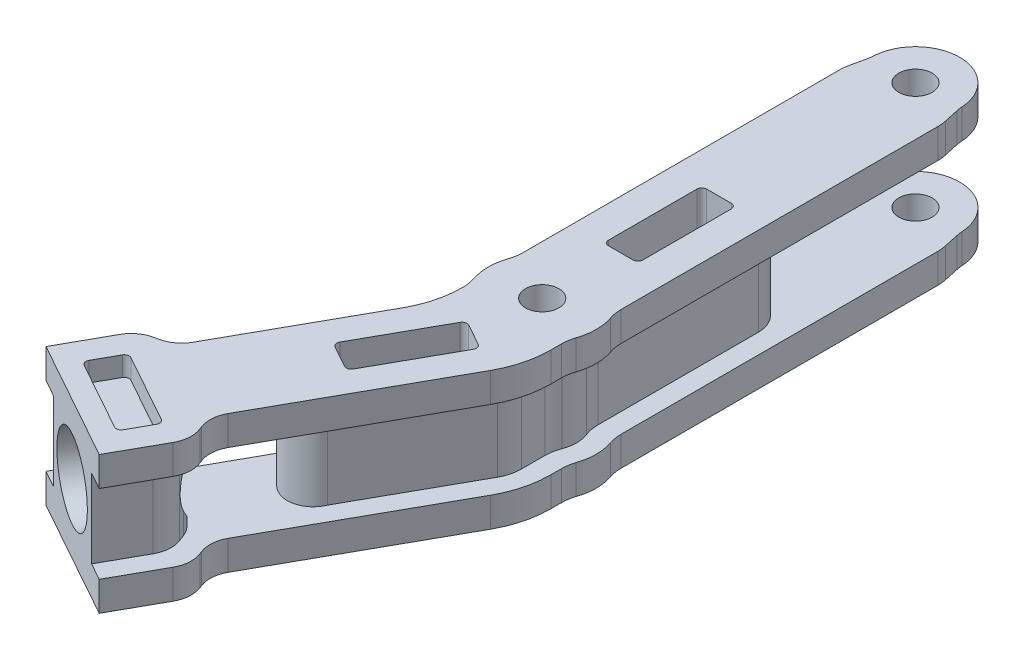
from build123d import *

# Parameters (mm, degrees)
SKETCH_1_R           = 1.75
EXTRUDE_1_DEPTH      = 3
EXTRUDE_START        = -3
EXTRUDE_2_DEPTH      = 3
SKETCH_5_R           = 2
CUT_EXTRUDE_1_DEPTH  = 10
SKETCH_8_R           = 1.6
SKETCH_8_R_2         = 2
SKETCH_8_R_3         = 1.75
EXTRUDE_4_DEPTH      = 3
SKETCH_9_R           = 3
SKETCH_9_R_2         = 2.62080722
EXTRUDE_5_DEPTH      = 14
EXTRUDE_6_REACH      = 53.947
SKETCH_11_R          = 1.5
CUT_EXTRUDE_2_DEPTH  = 6
EXTRUDE_START_2      = -14
EXTRUDE_7_DEPTH      = 14
SKETCH_14_R          = 3.5
SKETCH_14_R_2        = 1.7
EXTRUDE_8_DEPTH      = 14
SKETCH_15_R          = 1.6
EXTRUDE_9_DEPTH      = 3
SKETCH_16_R          = 1.7
SKETCH_16_R_2        = 1.6
EXTRUDE_10_DEPTH     = 3
EXTRUDE_START_3      = 8
SKETCH_18_R          = 2.6
SKETCH_18_R_2        = 1.6
SKETCH_18_R_3        = 3
EXTRUDE_11_DEPTH     = 8
SKETCH_20_W          = 10
SKETCH_20_H          = 14
EXTRUDE_13_DEPTH     = 2
CUT_EXTRUDE_START    = -100
CUT_EXTRUDE_3_DEPTH  = 100
FILLET_1_R           = 10
FILLET_2_R           = 4
FILLET_3_R           = 4
FILLET_4_R           = 10
FILLET_5_R           = 3
FILLET_6_R           = 4
SKETCH_22_W          = 3.5
SKETCH_22_H          = 10
CUT_EXTRUDE_4_DEPTH  = 100
CUT_EXTRUDE_5_DEPTH  = 100
FILLET_7_R           = 0.5
CUT_EXTRUDE_6_REACH  = 78.885
SKETCH_24_R          = 1.45
FILLET_8_R           = 4
FILLET_9_R           = 4
CUT_EXTRUDE_START_2  = -6
SKETCH_25_R          = 1.7
CUT_EXTRUDE_7_DEPTH  = 6
SKETCH_26_R          = 1.7
CUT_EXTRUDE_8_DEPTH  = 50
CUT_EXTRUDE_9_DEPTH  = 2
CUT_EXTRUDE_10_DEPTH = 2
FILLET_10_R          = 0.5
SKETCH_29_R          = 4
CUT_EXTRUDE_11_DEPTH = 14


with BuildPart() as part:
    # 草图1 → 凸台-拉伸1 (new body)
    with BuildSketch(Plane(origin=(0, 0, 0), x_dir=(1, 0, 0), z_dir=(0, 1, 0))):
        with BuildLine():
            Line((-3, 17.197224362), (-3, -17.197224362))
            ThreePointArc((-3, -17.197224362), (0, -22.5), (3, -17.197224362))
            Line((3, -17.197224362), (3, 17.197224362))
            ThreePointArc((3, 17.197224362), (0, 22.5), (-3, 17.197224362))
        make_face()
        with Locations(Location((0, 19, 0), (0, 0, 270))):
            Circle(SKETCH_1_R, mode=Mode.SUBTRACT)
        with Locations(Location((0, -19, 0), (0, 0, 90))):
            Circle(SKETCH_1_R, mode=Mode.SUBTRACT)
    extrude(amount=EXTRUDE_1_DEPTH)

    # 草图4 → 凸台-拉伸2 (add)
    with BuildSketch(Plane(origin=(0, 3, 0), x_dir=(1, 0, 0), z_dir=(0, 1, 0)).offset(EXTRUDE_START)):
        with BuildLine():
            ThreePointArc((3, -20.802775638), (0, -22.5), (-3, -20.802775638))
            Line((-3, -20.802775638), (-3, -25.197224362))
            Line((-3, -25.197224362), (-14.254126999, -45.4003011))
            Line((-14.254126999, -45.4003011), (-9.675040009, -47.951082211))
            Line((-9.675040009, -47.951082211), (3, -25.197224362))
            Line((3, -25.197224362), (3, -20.802775638))
        make_face()
    extrude(amount=EXTRUDE_2_DEPTH)

    # 草图5 → 切除-拉伸1 (cut)
    with BuildSketch(Plane(origin=(0, 3, 0), x_dir=(1, 0, 0), z_dir=(0, 1, 0))):
        with Locations(Location((0, 0, 0), (0, 0, 270))):
            Circle(SKETCH_5_R)
        with Locations(Location((-6.124899246, -36.192462775, 0), (0, 0, 270))):
            Circle(SKETCH_5_R)
    extrude(amount=-CUT_EXTRUDE_1_DEPTH, mode=Mode.SUBTRACT)



with BuildPart() as body_2:
    # 草图8 → 凸台-拉伸4 (new body)
    with BuildSketch(Plane(origin=(0, -8, 0), x_dir=(-1, 0, 0), z_dir=(0, -1, 0))):
        with BuildLine():
            Line((-3, 17.197224362), (-3, -17.197224362))
            ThreePointArc((-3, -17.197224362), (-3.5, -19), (-3, -20.802775638))
            Line((-3, -20.802775638), (-3, -25.197224362))
            Line((-3, -25.197224362), (9.675040009, -47.951082211))
            Line((9.675040009, -47.951082211), (14.254126999, -45.4003011))
            Line((14.254126999, -45.4003011), (3, -25.197224362))
            Line((3, -25.197224362), (3, -20.802775638))
            ThreePointArc((3, -20.802775638), (3.5, -19), (3, -17.197224362))
            Line((3, -17.197224362), (3, 17.197224362))
            ThreePointArc((3, 17.197224362), (0, 22.5), (-3, 17.197224362))
        make_face()
        with Locations(Location((0, 19, 0), (0, 0, 90))):
            Circle(SKETCH_8_R, mode=Mode.SUBTRACT)
        with Locations(Location((0, 0, 0), (0, 0, 270))):
            Circle(SKETCH_8_R_2, mode=Mode.SUBTRACT)
        with Locations(Location((0, -19, 0), (0, 0, 90))):
            Circle(SKETCH_8_R_3, mode=Mode.SUBTRACT)
        with Locations(Location((6.124899246, -36.192462775, 0), (0, 0, 270))):
            Circle(SKETCH_8_R_2, mode=Mode.SUBTRACT)
    extrude(amount=EXTRUDE_4_DEPTH)


with BuildPart() as part_1:
    add(part.part)

    add(body_2.part)  # 凸台-拉伸5 merges body 2
    # 草图9 → 凸台-拉伸5 (add)
    with BuildSketch(Plane(origin=(0, 3, 0), x_dir=(1, 0, 0), z_dir=(0, 1, 0))):
        Circle(SKETCH_9_R)
        with Locations(Location((-6.124899246, -36.192462775, 0), (0, 0, 330.88))):
            Circle(SKETCH_9_R_2)
    extrude(amount=-EXTRUDE_5_DEPTH)

    # 凸台-拉伸6: up to this face of the body (flat: up to its plane)
    extrude_6_end = Plane(part_1.part.faces().sort_by_distance((-1.92146971, 3, 12.783833811))[0])
    # 草图10 → 凸台-拉伸6 (add, up to the picked face)
    with BuildSketch(Plane.XZ.offset(11), mode=Mode.PRIVATE) as extrude_6_sk1:
        Polygon((-14.254126999, 45.4003011), (-11.964583504, 46.675691655), (-9.675040009, 47.951082211), (-7.59657147, 49.10889343), (-9.54313289, 52.603303056), (-18.279156957, 47.736899508), (-16.332595538, 44.242489881), align=None)
    extrude_6_tool1 = split(extrude(extrude_6_sk1.sketch, amount=-EXTRUDE_6_REACH, mode=Mode.PRIVATE), bisect_by=extrude_6_end, keep=Keep.BOTH, mode=Mode.PRIVATE)
    # 草图10 → 凸台-拉伸6 (add, up to the picked face)
    with BuildSketch(Plane.XZ.offset(11), mode=Mode.PRIVATE) as extrude_6_sk2:
        Polygon((-9.675040009, 47.951082211), (-11.964583504, 46.675691655), (-10.991302794, 44.928486842), (-8.701759299, 46.203877397), align=None)
    extrude_6_tool2 = split(extrude(extrude_6_sk2.sketch, amount=-EXTRUDE_6_REACH, mode=Mode.PRIVATE), bisect_by=extrude_6_end, keep=Keep.BOTH, mode=Mode.PRIVATE)
    # 草图10 → 凸台-拉伸6 (add, up to the picked face)
    with BuildSketch(Plane.XZ.offset(11), mode=Mode.PRIVATE) as extrude_6_sk3:
        Polygon((-10.991302794, 44.928486842), (-11.964583504, 46.675691655), (-14.254126999, 45.4003011), (-13.28084629, 43.653096286), align=None)
    extrude_6_tool3 = split(extrude(extrude_6_sk3.sketch, amount=-EXTRUDE_6_REACH, mode=Mode.PRIVATE), bisect_by=extrude_6_end, keep=Keep.BOTH, mode=Mode.PRIVATE)
    add(extrude_6_tool1.solids().sort_by(Axis((-12.937864, -11, 48.422896), (0, 1, 0)))[0])
    add(extrude_6_tool2.solids().sort_by(Axis((-10.333171, -11, 46.439785), (0, 1, 0)))[0])
    add(extrude_6_tool3.solids().sort_by(Axis((-12.622715, -11, 45.164394), (0, 1, 0)))[0])

    # 草图11 → 切除-拉伸2 (cut)
    with BuildSketch(Plane(origin=(-24.623245583, 0, 44.202923965), x_dir=(0.8736024067325182, 0, 0.4866403548321407), z_dir=(-0.4866403548321407, 0, 0.8736024067325182))):
        with Locations((12.261986204, -4)):
            Circle(SKETCH_11_R)
    extrude(amount=-CUT_EXTRUDE_2_DEPTH, mode=Mode.SUBTRACT)

    # 草图12 → 凸台-拉伸7 (add)
    with BuildSketch(Plane(origin=(0, 3, 0), x_dir=(1, 0, 0), z_dir=(0, 1, 0)).offset(EXTRUDE_START_2)):
        Polygon((-16.332595538, -44.242489881), (-14.254126999, -45.4003011), (-13.28084629, -43.653096286), align=None)
        Polygon((-9.675040009, -47.951082211), (-8.701759299, -46.203877397), (-7.59657147, -49.10889343), align=None)
    extrude(amount=EXTRUDE_7_DEPTH)

    # 草图14 → 凸台-拉伸8 (add)
    with BuildSketch(Plane.XZ.offset(11)):
        with Locations(Location((0, 19, 0), (0, 0, 211.002719134))):
            Circle(SKETCH_14_R)
        with Locations(Location((0, 19, 0), (0, 0, 270))):
            Circle(SKETCH_14_R_2, mode=Mode.SUBTRACT)
    extrude(amount=-EXTRUDE_8_DEPTH)

    # 草图15 → 凸台-拉伸9 (add)
    with BuildSketch(Plane.XZ.offset(11).offset(EXTRUDE_START)):
        with BuildLine():
            Line((5, -16.708712153), (5, 16.708712153))
            ThreePointArc((5, 16.708712153), (5.5, 19), (5, 21.291287847))
            Line((5, 21.291287847), (5, 25.716694612))
            Line((5, 25.716694612), (-6.501234748, 46.363371889))
            Line((-6.501234748, 46.363371889), (-5.396046919, 49.268387921))
            Line((-5.396046919, 49.268387921), (-8.769208786, 55.32378858))
            Line((-8.769208786, 55.32378858), (-20.99964248, 48.510823612))
            Line((-20.99964248, 48.510823612), (-17.626480614, 42.455422953))
            Line((-17.626480614, 42.455422953), (-14.574731365, 41.866029359))
            Line((-14.574731365, 41.866029359), (-5, 24.677754113))
            Line((-5, 24.677754113), (-5, 21.291287847))
            ThreePointArc((-5, 21.291287847), (-5.5, 19), (-5, 16.708712153))
            Line((-5, 16.708712153), (-5, -16.708712153))
            ThreePointArc((-5, -16.708712153), (0, -24.5), (5, -16.708712153))
        make_face()
        with Locations(Location((0, 19, 0), (0, 0, 270))):
            Circle(SKETCH_15_R, mode=Mode.SUBTRACT)
        with Locations(Location((0, -19, 0), (0, 0, 270))):
            Circle(SKETCH_15_R, mode=Mode.SUBTRACT)
    extrude(amount=EXTRUDE_9_DEPTH)

    # 草图16 → 凸台-拉伸10 (add)
    with BuildSketch(Plane(origin=(0, 3, 0), x_dir=(1, 0, 0), z_dir=(0, 1, 0))):
        with BuildLine():
            Line((5, -25.716694612), (5, -21.291287847))
            ThreePointArc((5, -21.291287847), (5.5, -19), (5, -16.708712153))
            Line((5, -16.708712153), (5, 16.708712153))
            ThreePointArc((5, 16.708712153), (0, 24.5), (-5, 16.708712153))
            Line((-5, 16.708712153), (-5, -16.708712153))
            ThreePointArc((-5, -16.708712153), (-5.5, -19), (-5, -21.291287847))
            Line((-5, -21.291287847), (-5, -24.677754113))
            Line((-5, -24.677754113), (-14.574731365, -41.866029359))
            Line((-14.574731365, -41.866029359), (-17.626480614, -42.455422953))
            Line((-17.626480614, -42.455422953), (-20.99964248, -48.510823612))
            Line((-20.99964248, -48.510823612), (-8.769208786, -55.32378858))
            Line((-8.769208786, -55.32378858), (-5.396046919, -49.268387921))
            Line((-5.396046919, -49.268387921), (-6.501234748, -46.363371889))
            Line((-6.501234748, -46.363371889), (5, -25.716694612))
        make_face()
        with Locations(Location((0, 19, 0), (0, 0, 270))):
            Circle(SKETCH_16_R, mode=Mode.SUBTRACT)
        with Locations(Location((0, -19, 0), (0, 0, 90))):
            Circle(SKETCH_16_R_2, mode=Mode.SUBTRACT)
    extrude(amount=-EXTRUDE_10_DEPTH)

    # 草图18 → 凸台-拉伸11 (add)
    # profile 1 of 7: a face of its own
    with BuildSketch(Plane.XZ.offset(EXTRUDE_START_3)):
        with BuildLine():
            Line((3, 25.154467489), (-3.693140517, 37.169795864))
            ThreePointArc((-3.693140517, 37.169795864), (-3.55178816, 36.690187422), (-3.504092026, 36.192462775))
            ThreePointArc((-3.504092026, 36.192462775), (-5.307533004, 33.702373838), (-8.235873032, 34.639266019))
            Line((-8.235873032, 34.639266019), (-3, 25.239981236))
            Line((-3, 25.239981236), (-3, 20.802775638))
            ThreePointArc((-3, 20.802775638), (0, 22.5), (3, 20.802775638))
            Line((3, 20.802775638), (3, 25.154467489))
        make_face()
    # profile 2 of 7: a face of its own
    with BuildSketch(Plane.XZ.offset(EXTRUDE_START_3)):
        with Locations((-6.124899246, 36.192462775)):
            Circle(SKETCH_18_R)
    # profile 3 of 7: a face of its own
    with BuildSketch(Plane.XZ.offset(EXTRUDE_START_3)):
        with BuildLine():
            Line((3, 17.197224362), (3, 20.802775638))
            ThreePointArc((3, 20.802775638), (0, 22.5), (-3, 20.802775638))
            Line((-3, 20.802775638), (-3, 17.197224362))
            ThreePointArc((-3, 17.197224362), (0, 15.5), (3, 17.197224362))
        make_face()
        with Locations(Location((0, 19, 0), (0, 0, 270))):
            Circle(SKETCH_18_R_2, mode=Mode.SUBTRACT)
    # profile 4 of 7: a face of its own
    with BuildSketch(Plane.XZ.offset(EXTRUDE_START_3)):
        with BuildLine():
            Line((3, 0), (3, 17.197224362))
            ThreePointArc((3, 17.197224362), (0, 15.5), (-3, 17.197224362))
            Line((-3, 17.197224362), (-3, 0))
            ThreePointArc((-3, 0), (0, 3), (3, 0))
        make_face()
    # profile 5 of 7: a face of its own
    with BuildSketch(Plane.XZ.offset(EXTRUDE_START_3)):
        Circle(SKETCH_18_R_3)
    # profile 6 of 7: a face of its own
    with BuildSketch(Plane.XZ.offset(EXTRUDE_START_3)):
        with BuildLine():
            Line((-3, 17.197224362), (-3, 20.802775638))
            ThreePointArc((-3, 20.802775638), (-3.5, 19), (-3, 17.197224362))
        make_face()
    # profile 7 of 7: a face of its own
    with BuildSketch(Plane.XZ.offset(EXTRUDE_START_3)):
        with BuildLine():
            ThreePointArc((3.5, 19), (3.372684391, 19.935414347), (3, 20.802775638))
            Line((3, 20.802775638), (3, 17.197224362))
            ThreePointArc((3, 17.197224362), (3.372684391, 18.064585653), (3.5, 19))
        make_face()
    extrude(amount=-EXTRUDE_11_DEPTH)

    # 草图20 → 凸台-拉伸13 (add)
    with BuildSketch(Plane(origin=(-24.623245583, 0, 44.202923965), x_dir=(0.8736024067325182, 0, 0.4866403548321407), z_dir=(-0.4866403548321407, 0, 0.8736024067325182))):
        with Locations((12.261986204, -4)):
            Rectangle(SKETCH_20_W, SKETCH_20_H)
    extrude(amount=EXTRUDE_13_DEPTH)

    # 草图21 → 切除-拉伸3 (cut)
    with BuildSketch(Plane.XZ.offset(11).offset(CUT_EXTRUDE_START)):
        with BuildLine():
            ThreePointArc((5.5, -19), (5.373546315, -17.82739606), (5, -16.708712153))
            Line((5, -16.708712153), (4.5, -19))
            ThreePointArc((4.5, -19), (0, -23.5), (-4.5, -19))
            Line((-4.5, -19), (-5, -16.708712153))
            ThreePointArc((-5, -16.708712153), (-1.17260394, -24.373546315), (5.5, -19))
        make_face()
    extrude(amount=CUT_EXTRUDE_3_DEPTH, mode=Mode.SUBTRACT)

    # 圆角1
    fillet_1_edges = [part_1.edges().sort_by_distance(p)[0] for p in [
        (5, -9.5, 25.716694612),
        (5, 1.5, 25.716694612),
    ]]
    fillet(fillet_1_edges, radius=FILLET_1_R)

    # 圆角2
    fillet_2_edges = [part_1.edges().sort_by_distance(p)[0] for p in [
        (5, -9.5, 16.708712153),
        (5, -9.5, 21.291287847),
        (5, 1.5, 21.291287847),
        (5, 1.5, 16.708712153),
    ]]
    fillet(fillet_2_edges, radius=FILLET_2_R)

    # 圆角3
    fillet_3_edges = [part_1.edges().sort_by_distance(p)[0] for p in [
        (-5, -9.5, 21.291287847),
        (-5, -9.5, 16.708712153),
        (-5, 1.5, 16.708712153),
        (-5, 1.5, 21.291287847),
    ]]
    fillet(fillet_3_edges, radius=FILLET_3_R)

    # 圆角4
    fillet_4_edges = [part_1.edges().sort_by_distance(p)[0] for p in [
        (-5, -9.5, 24.677754113),
        (-5, 1.5, 24.677754113),
    ]]
    fillet(fillet_4_edges, radius=FILLET_4_R)

    # 圆角5
    fillet_5_edges = [part_1.edges().sort_by_distance(p)[0] for p in [
        (-13.28084629, -4, 43.653096286),
        (-8.701759299, -4, 46.203877397),
        (-6.501234748, -9.5, 46.363371889),
        (-5.396046919, -9.5, 49.268387921),
        (-17.626480614, -9.5, 42.455422953),
        (-14.574731365, -9.5, 41.866029359),
        (-7.59657147, -4, 49.10889343),
        (-16.332595538, -4, 44.242489881),
        (-14.574731365, 1.5, 41.866029359),
        (-17.626480614, 1.5, 42.455422953),
        (-5.396046919, 1.5, 49.268387921),
        (-6.501234748, 1.5, 46.363371889),
    ]]
    fillet(fillet_5_edges, radius=FILLET_5_R)

    # 圆角6
    fillet_6_edges = [part_1.edges().sort_by_distance(p)[0] for p in [
        (-5, -9.5, -16.708712153),
        (5, -9.5, -16.708712153),
        (5, 1.5, -16.708712153),
        (-5, 1.5, -16.708712153),
        (-4.5, 1.5, -19),
        (-4.5, -9.5, -19),
        (4.5, 1.5, -19),
        (4.5, -9.5, -19),
    ]]
    fillet(fillet_6_edges, radius=FILLET_6_R)

    # 草图22 → 切除-拉伸4 (cut)
    with BuildSketch(Plane(origin=(0, 3, 0), x_dir=(1, 0, 0), z_dir=(0, 1, 0))):
        with Locations((0, -6)):
            Rectangle(SKETCH_22_W, SKETCH_22_H)
    extrude(amount=-CUT_EXTRUDE_4_DEPTH, mode=Mode.SUBTRACT)

    # 草图23 → 切除-拉伸5 (cut)
    with BuildSketch(Plane(origin=(0, 3, 0), x_dir=(1, 0, 0), z_dir=(0, 1, 0))):
        Polygon((1.243589224, -26.560854515), (-1.8140192, -24.857613273), (-6.680422748, -33.59363734), (-3.622814325, -35.296878582), align=None)
    extrude(amount=-CUT_EXTRUDE_5_DEPTH, mode=Mode.SUBTRACT)

    # 圆角7
    fillet_7_edges = [part_1.edges().sort_by_distance(p)[0] for p in [
        (1.75, -4, 1),
        (1.75, -4, 11),
        (-1.75, -4, 11),
        (-1.75, -4, 1),
        (1.243589224, -4, 26.560854515),
        (-3.622814325, -4, 35.296878582),
        (-6.680422748, -4, 33.59363734),
        (-1.8140192, -4, 24.857613273),
    ]]
    fillet(fillet_7_edges, radius=FILLET_7_R)

    # 切除-拉伸6: up to this face of the body (flat: up to its plane)
    cut_extrude_6_end = Plane(part_1.part.faces().sort_by_distance((-10.991302794, -7.914366148, 44.928486842))[0])
    # 草图24 → 切除-拉伸6 (cut, up to the picked face)
    with BuildSketch(Plane(origin=(-25.596526293, 0, 45.950128778), x_dir=(0.8736024067325187, 0, 0.48664035483214), z_dir=(-0.48664035483214, 0, 0.8736024067325187)), mode=Mode.PRIVATE) as cut_extrude_6_sk1:
        with Locations((12.134119917, -4)):
            Circle(SKETCH_24_R)
    cut_extrude_6_tool1 = split(extrude(cut_extrude_6_sk1.sketch, amount=-CUT_EXTRUDE_6_REACH, mode=Mode.PRIVATE), bisect_by=cut_extrude_6_end, keep=Keep.BOTH, mode=Mode.PRIVATE)
    add(cut_extrude_6_tool1.solids().sort_by(Axis((-14.99613, -4, 51.855081), (0.48664035483214, 0, -0.8736024067325187)))[0], mode=Mode.SUBTRACT)

    # 圆角8
    fillet_8_edges = [part_1.edges().sort_by_distance(p)[0] for p in [
        (3, -4, 25.154467489),
        (3, -4, 20.802775638),
        (3, -4, 17.197224362),
    ]]
    fillet(fillet_8_edges, radius=FILLET_8_R)

    # 圆角9
    fillet_9_edges = [part_1.edges().sort_by_distance(p)[0] for p in [
        (-3, -4, 17.197224362),
        (-3, -4, 20.802775638),
        (-3, -4, 25.239981236),
    ]]
    fillet(fillet_9_edges, radius=FILLET_9_R)

    # 草图25 → 切除-拉伸7 (cut)
    with BuildSketch(Plane.XZ.offset(11).offset(CUT_EXTRUDE_START_2)):
        with Locations(Location((0, -19, 0), (0, 0, 90))):
            Circle(SKETCH_25_R)
    extrude(amount=CUT_EXTRUDE_7_DEPTH, mode=Mode.SUBTRACT)

    # 草图26 → 切除-拉伸8 (cut)
    with BuildSketch(Plane.XZ.offset(11)):
        with Locations(Location((0, 19, 0), (0, 0, 270))):
            Circle(SKETCH_26_R)
    extrude(amount=-CUT_EXTRUDE_8_DEPTH, mode=Mode.SUBTRACT)

    # 草图27 → 切除-拉伸9 (cut)
    with BuildSketch(Plane(origin=(0, 3, 0), x_dir=(1, 0, 0), z_dir=(0, 1, 0))):
        Polygon((-16.139114512, -44.922611262), (-8.276692851, -49.302374455), (-9.979934093, -52.359982879), (-17.842355754, -47.980219686), align=None)
    extrude(amount=-CUT_EXTRUDE_9_DEPTH, mode=Mode.SUBTRACT)

    # 草图28 → 切除-拉伸10 (cut)
    with BuildSketch(Plane.XZ.offset(11)):
        Polygon((-8.276692851, 49.302374455), (-16.139114512, 44.922611262), (-17.842355754, 47.980219686), (-9.979934093, 52.359982879), align=None)
    extrude(amount=-CUT_EXTRUDE_10_DEPTH, mode=Mode.SUBTRACT)

    # 圆角10
    fillet_10_edges = [part_1.edges().sort_by_distance(p)[0] for p in [
        (-17.842355754, 2, 47.980219686),
        (-16.139114512, 2, 44.922611262),
        (-8.276692851, 2, 49.302374455),
        (-9.979934093, 2, 52.359982879),
        (-9.979934093, -10, 52.359982879),
        (-8.276692851, -10, 49.302374455),
        (-16.139114512, -10, 44.922611262),
        (-17.842355754, -10, 47.980219686),
    ]]
    fillet(fillet_10_edges, radius=FILLET_10_R)

    # 草图29 → 切除-拉伸11 (cut)
    with BuildSketch(Plane(origin=(-25.596526293, 0, 45.950128778), x_dir=(0.8736024067325187, 0, 0.48664035483214), z_dir=(-0.48664035483214, 0, 0.8736024067325187))):
        with Locations((12.134119917, -4)):
            Circle(SKETCH_29_R)
    extrude(amount=-CUT_EXTRUDE_11_DEPTH, mode=Mode.SUBTRACT)


solid = part_1.part
